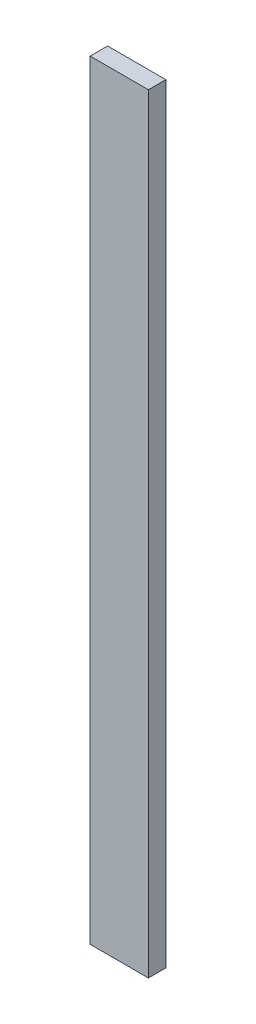
from build123d import *

# Parameters (mm, degrees)
SKETCH1_W           = 63.5
SKETCH1_H           = 838.2
BOSS_EXTRUDE1_DEPTH = 19.05


with BuildPart() as part:
    # Sketch1 → Boss-Extrude1 (new body)
    with BuildSketch(Plane.XY):
        with Locations((-17.391955174, 387.724751696)):
            Rectangle(SKETCH1_W, SKETCH1_H)
    extrude(amount=BOSS_EXTRUDE1_DEPTH)


solid = part.part
